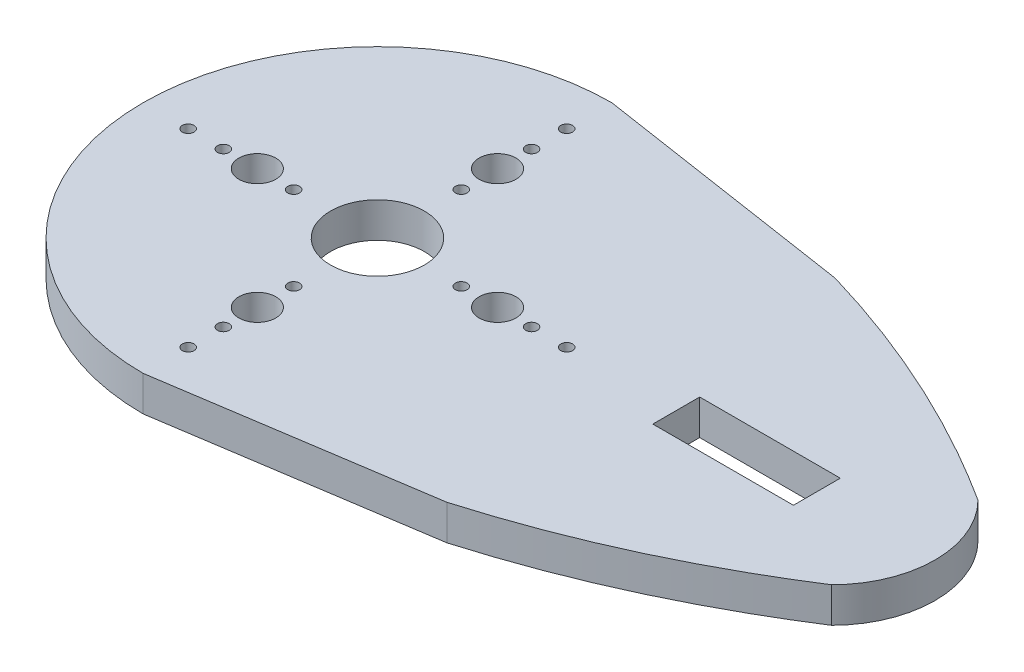
from build123d import *

# Parameters (mm, degrees)
SKETCH1_R           = 0.5
SKETCH1_R_2         = 1.575
SKETCH1_W           = 12
SKETCH1_H           = 4
BOSS_EXTRUDE1_DEPTH = 3


with BuildPart() as part:
    # Sketch1 → Boss-Extrude1 (new body)
    with BuildSketch(Plane(origin=(0, 0, 0), x_dir=(1, 0, 0), z_dir=(0, 1, 0))):
        with BuildLine():
            add(Edge.make_bspline(
                [(22.5, -16.5625), (34.262295129, -13.118708317), (45, -6.25)],
                knots=[0.479061635, 0.479061635, 0.479061635, 1, 1, 1], degree=2))
            ThreePointArc((45, -6.25), (47.588834765, 0), (45, 6.25))
            add(Edge.make_bspline(
                [(22.5, 16.5625), (34.262295129, 13.118708317), (45, 6.25)],
                knots=[0.479061635, 0.479061635, 0.479061635, 1, 1, 1], degree=2))
            Line((22.5, 16.5625), (0, 20))
            ThreePointArc((0, 20), (-20, 0), (0, -20))
            Line((0, -20), (22.5, -16.5625))
        make_face()
        with Locations(Location((0, -16.15, 0), (0, 0, 270))):
            Circle(SKETCH1_R, mode=Mode.SUBTRACT)
        with Locations(Location((0, -13.15, 0), (0, 0, 270))):
            Circle(SKETCH1_R, mode=Mode.SUBTRACT)
        with Locations(Location((0, -10.25, 0), (0, 0, 270))):
            Circle(SKETCH1_R_2, mode=Mode.SUBTRACT)
        with Locations(Location((-16.15, 0, 0), (0, 0, 270))):
            Circle(SKETCH1_R, mode=Mode.SUBTRACT)
        with BuildLine():
            ThreePointArc((-13.65, 0), (-13.15, 0.5), (-12.65, 0))
            ThreePointArc((-12.65, 0), (-13.15, -0.5), (-13.65, 0))
        make_face(mode=Mode.SUBTRACT)
        with BuildLine():
            ThreePointArc((-7.65, 0), (-7.15, 0.5), (-6.65, 0))
            ThreePointArc((-6.65, 0), (-7.15, -0.5), (-7.65, 0))
        make_face(mode=Mode.SUBTRACT)
        with Locations(Location((0, -7.15, 0), (0, 0, 270))):
            Circle(SKETCH1_R, mode=Mode.SUBTRACT)
        with BuildLine():
            ThreePointArc((3.177944539, 2.429129166), (1.282228888, -3.78891661), (-4, 0))
            ThreePointArc((-4, 0), (-1.282228888, 3.78891661), (3.177944539, 2.429129166))
        make_face(mode=Mode.SUBTRACT)
        with Locations(Location((7.15, 0, 0), (0, 0, 270))):
            Circle(SKETCH1_R, mode=Mode.SUBTRACT)
        with Locations(Location((10.25, 0, 0), (0, 0, 270))):
            Circle(SKETCH1_R_2, mode=Mode.SUBTRACT)
        with Locations(Location((13.15, 0, 0), (0, 0, 270))):
            Circle(SKETCH1_R, mode=Mode.SUBTRACT)
        with Locations(Location((16.15, 0, 0), (0, 0, 270))):
            Circle(SKETCH1_R, mode=Mode.SUBTRACT)
        with BuildLine():
            ThreePointArc((-11.825, 0), (-10.25, 1.575), (-8.675, 0))
            ThreePointArc((-8.675, 0), (-10.25, -1.575), (-11.825, 0))
        make_face(mode=Mode.SUBTRACT)
        with Locations(Location((0, 7.15, 0), (0, 0, 270))):
            Circle(SKETCH1_R, mode=Mode.SUBTRACT)
        with Locations(Location((0, 10.25, 0), (0, 0, 270))):
            Circle(SKETCH1_R_2, mode=Mode.SUBTRACT)
        with Locations(Location((0, 13.15, 0), (0, 0, 270))):
            Circle(SKETCH1_R, mode=Mode.SUBTRACT)
        with Locations(Location((0, 16.15, 0), (0, 0, 270))):
            Circle(SKETCH1_R, mode=Mode.SUBTRACT)
        with Locations((31.5, 0)):
            Rectangle(SKETCH1_W, SKETCH1_H, mode=Mode.SUBTRACT)
    extrude(amount=BOSS_EXTRUDE1_DEPTH)


solid = part.part
